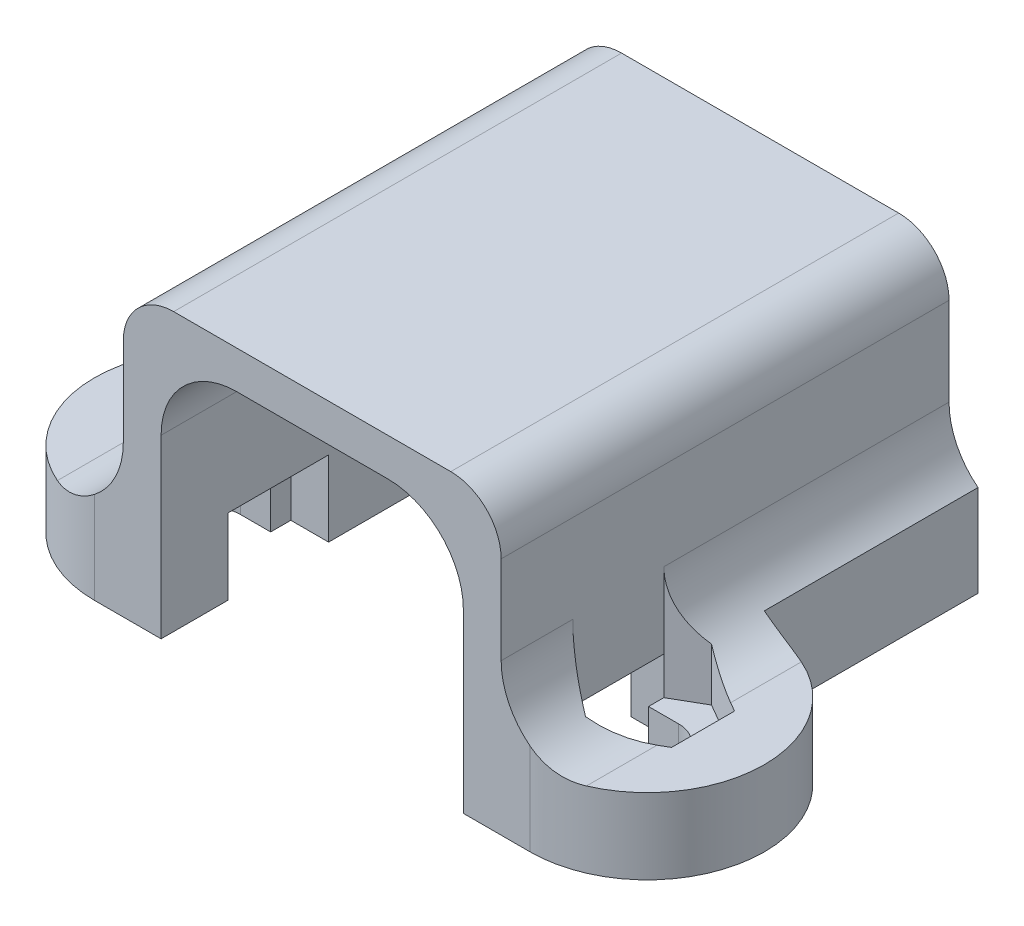
from build123d import *

# Parameters (mm, degrees)
BOSS_EXTRUDE1_DEPTH     = 17.78
FILLET1_R               = 2
FILLET2_R               = 3
CUT_EXTRUDE5_DEPTH      = 34.999094106
CUT_EXTRUDE6_DEPTH      = 3
CUT_EXTRUDE7_DEPTH      = 3
CUT_EXTRUDE7_DEPTH_BACK = 1.5
BOSS_EXTRUDE2_DEPTH     = 8


with BuildPart() as part:
    # Sketch1 → Boss-Extrude1 (new body)
    with BuildSketch(Plane.XY):
        Polygon((0, 3), (0, 0), (7.3, 0), (7.3, 10), (13.3, 10), (19.3, 10), (19.3, 0), (26.6, 0), (26.6, 3), (20.8, 3), (20.8, 11.5), (5.8, 11.5), (5.8, 3), align=None)
    extrude(amount=-BOSS_EXTRUDE1_DEPTH)

    # Fillet1
    fillet1_edges = [part.edges().sort_by_distance(p)[0] for p in [
        (5.8, 11.5, -8.89),
        (20.8, 11.5, -8.89),
    ]]
    fillet(fillet1_edges, radius=FILLET1_R)

    # Fillet2
    fillet2_edges = [part.edges().sort_by_distance(p)[0] for p in [
        (5.8, 3, -8.89),
        (20.8, 3, -8.89),
    ]]
    fillet(fillet2_edges, radius=FILLET2_R)

    # Sketch2 → Cut-Extrude5 (cut, through all)
    with BuildSketch(Plane(origin=(0, 0, 0), x_dir=(1, 0, 0), z_dir=(0, 1, 0))):
        with BuildLine():
            Line((0, 17.78), (0, 4.65))
            ThreePointArc((0, 4.65), (1.361953467, 7.938046533), (4.65, 9.3))
            Line((4.65, 9.3), (4.65, 17.78))
            Line((4.65, 17.78), (0, 17.78))
        make_face()
        with BuildLine():
            Line((0, 4.65), (0, 0))
            Line((0, 0), (4.65, 0))
            ThreePointArc((4.65, 0), (1.361953467, 1.361953467), (0, 4.65))
        make_face()
        with BuildLine():
            ThreePointArc((21.95, 9.3), (25.238046535, 7.93804653), (26.6, 4.649999993))
            Line((26.6, 4.649999993), (26.6, 17.78))
            Line((26.6, 17.78), (21.95, 17.78))
            Line((21.95, 17.78), (21.95, 9.3))
        make_face()
        with BuildLine():
            Line((21.95, 0), (26.6, 0))
            Line((26.6, 0), (26.6, 4.649999993))
            ThreePointArc((26.6, 4.649999993), (25.23804653, 1.361953465), (21.95, 0))
        make_face()
    extrude(amount=CUT_EXTRUDE5_DEPTH, mode=Mode.SUBTRACT)

    # Sketch3 → Cut-Extrude6 (cut)
    with BuildSketch(Plane.XZ):
        with BuildLine():
            Line((7.3, -6.649999971), (7.3, -2.649999971))
            Line((7.3, -2.649999971), (5.8, -2.649999971))
            Line((5.8, -2.649999971), (5.8, -3.449999971))
            Line((5.8, -3.449999971), (4.6, -3.449999971))
            ThreePointArc((4.6, -3.449999971), (3.4, -4.649999971), (4.6, -5.849999971))
            Line((4.6, -5.849999971), (5.8, -5.849999971))
            Line((5.8, -5.849999971), (5.8, -6.649999971))
            Line((5.8, -6.649999971), (7.3, -6.649999971))
        make_face()
        with BuildLine():
            Line((20.8, -5.849999971), (22, -5.849999971))
            ThreePointArc((22, -5.849999971), (23.2, -4.649999971), (22, -3.449999971))
            Line((22, -3.449999971), (20.8, -3.449999971))
            Line((20.8, -3.449999971), (20.8, -2.649999971))
            Line((20.8, -2.649999971), (19.3, -2.649999971))
            Line((19.3, -2.649999971), (19.3, -6.649999971))
            Line((19.3, -6.649999971), (20.8, -6.649999971))
            Line((20.8, -6.649999971), (20.8, -5.849999971))
        make_face()
    extrude(amount=-CUT_EXTRUDE6_DEPTH, mode=Mode.SUBTRACT)

    # Sketch4 → Cut-Extrude7 (cut, two sides: drawn at the far end of the back side and taken through both)
    with BuildSketch(Plane(origin=(0, 3, 0), x_dir=(1, 0, 0), z_dir=(0, 1, 0)).offset(-CUT_EXTRUDE7_DEPTH_BACK)):
        Polygon((2.8, 3.189230456), (2.8, 6.110769486), (2.434936491, 5.899999971), (2.434936491, 3.399999971), align=None)
        Polygon((4.6, 2.149999971), (4.6, 4.649999971), (4.6, 7.149999971), (2.8, 6.110769486), (2.8, 3.189230456), align=None)
        Polygon((5.8, 2.842820294), (4.6, 2.149999971), (4.6, 4.649999971), (4.6, 7.149999971), (5.8, 6.457179648), align=None)
        Polygon((22, 2.149999971), (22, 4.649999971), (22, 7.149999971), (20.8, 6.457179648), (20.8, 2.842820294), align=None)
        Polygon((24.165063509, 5.899999971), (24.165063509, 3.399999971), (22, 2.149999971), (22, 4.649999971), (22, 7.149999971), align=None)
    extrude(amount=CUT_EXTRUDE7_DEPTH + CUT_EXTRUDE7_DEPTH_BACK, mode=Mode.SUBTRACT)

    # Sketch5 → Boss-Extrude2 (add)
    with BuildSketch(Plane(origin=(0, 0, 0), x_dir=(-1, 0, 0), z_dir=(0, 0, -1))):
        with BuildLine():
            Line((-16.3, 10), (-19.3, 10))
            Line((-19.3, 10), (-19.3, 7))
            ThreePointArc((-19.3, 7), (-18.421320344, 9.121320344), (-16.3, 10))
        make_face()
        with BuildLine():
            Line((-7.3, 7), (-7.3, 10))
            Line((-7.3, 10), (-10.3, 10))
            ThreePointArc((-10.3, 10), (-8.178679656, 9.121320344), (-7.3, 7))
        make_face()
    extrude(amount=BOSS_EXTRUDE2_DEPTH)


solid = part.part
